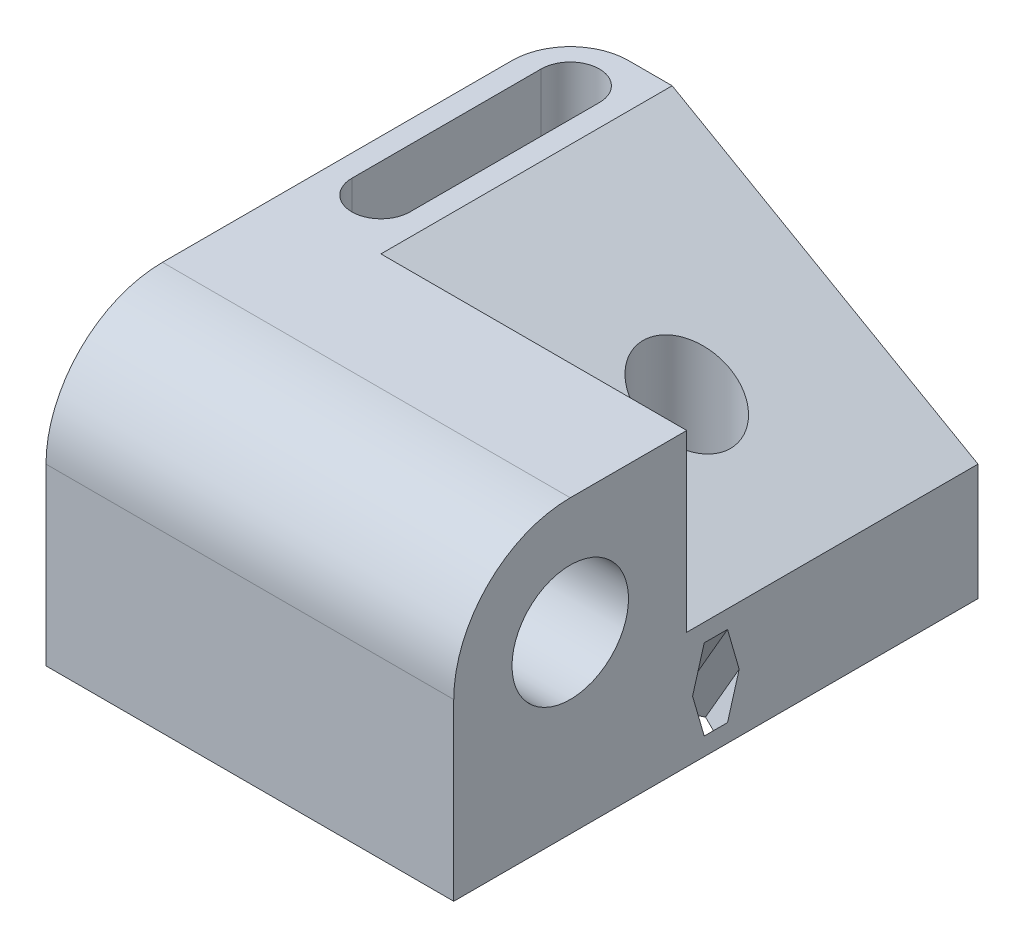
from build123d import *

# Parameters (mm, degrees)
SKETCH1_R           = 15
BOSS_EXTRUDE1_DEPTH = 100
CUT_EXTRUDE1_DEPTH  = 100
FILLET1_R           = 40
SKETCH3_R           = 20
CUT_EXTRUDE2_DEPTH  = 105
CUT_EXTRUDE3_DEPTH  = 191.523897853


with BuildPart() as part:
    # Sketch1 → Boss-Extrude1 (new body)
    with BuildSketch(Plane(origin=(0, 0, 0), x_dir=(1, 0, 0), z_dir=(0, 1, 0))):
        with BuildLine():
            Line((-50, -90), (70, -90))
            Line((70, -90), (70, 90))
            Line((70, 90), (-70, 90))
            Line((-70, 90), (-70, -70))
            ThreePointArc((-70, -70), (-64.142135624, -84.142135624), (-50, -90))
        make_face()
        with Locations(Location((25, -35, 0), (0, 0, 270))):
            Circle(SKETCH1_R, mode=Mode.SUBTRACT)
        with BuildLine():
            Line((-42.5, -7.5), (-42.5, -72.5))
            ThreePointArc((-42.5, -72.5), (-52.5, -82.5), (-62.5, -72.5))
            Line((-62.5, -72.5), (-62.5, -7.5))
            ThreePointArc((-62.5, -7.5), (-52.5, 2.5), (-42.5, -7.5))
        make_face(mode=Mode.SUBTRACT)
    extrude(amount=BOSS_EXTRUDE1_DEPTH)

    # Sketch2 → Cut-Extrude1 (cut)
    with BuildSketch(Plane.XY.offset(90)):
        Polygon((-35, 100), (70, 40), (70, 100), align=None)
    extrude(amount=-CUT_EXTRUDE1_DEPTH, mode=Mode.SUBTRACT)

    # Fillet1
    fillet1_edges = [part.edges().sort_by_distance(p)[0] for p in [
        (0, 100, -90),
    ]]
    fillet(fillet1_edges, radius=FILLET1_R)

    # Sketch3 → Cut-Extrude2 (cut)
    with BuildSketch(Plane(origin=(70, 0, 0), x_dir=(0, 0, -1), z_dir=(1, 0, 0))):
        with Locations((50, 60)):
            Circle(SKETCH3_R)
    extrude(amount=-CUT_EXTRUDE2_DEPTH, mode=Mode.SUBTRACT)

    # Sketch6 → Cut-Extrude3 (cut, through all)
    with BuildSketch(Plane(origin=(60.801270189, 105.310889132, 0), x_dir=(0, 0, -1), z_dir=(0.499999999999998, 0.8660254037844398, 0))):
        Polygon((8, -50.621778265), (4, -43.693575035), (-4, -43.693575035), (-8, -50.621778265), (-4, -57.549981495), (4, -57.549981495), align=None)
    extrude(amount=-CUT_EXTRUDE3_DEPTH, mode=Mode.SUBTRACT)


with BuildPart() as body_2:
    # Mirror1: mirrored copy
    add(part.part.mirror(Plane(origin=(-50, 100, 90), x_dir=(1, 0, 0), z_dir=(0, 0, -1))))


with BuildPart() as body_2_1:
    # Body-Move/Copy2: moved
    add(body_2.part.moved(Location((0, 0, -180))))


solid = body_2_1.part
